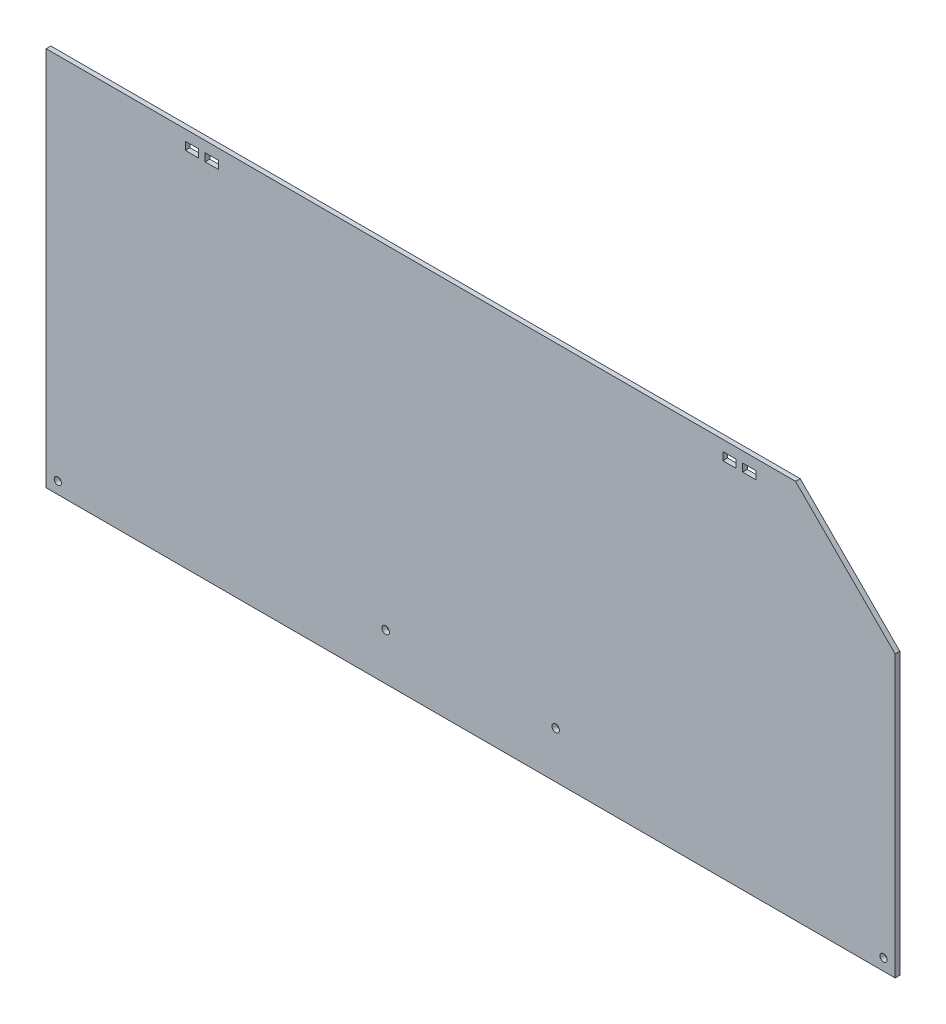
from build123d import *

# Parameters (mm, degrees)
EXTRUDE_1_DEPTH     = 4
SKETCH_2_W          = 11.5
SKETCH_2_H          = 6.8
CUT_EXTRUDE_1_DEPTH = 747.201380326
SKETCH_3_R          = 3.25
CUT_EXTRUDE_2_DEPTH = 747.201380326
SKETCH_4_R          = 3.1
CUT_EXTRUDE_3_DEPTH = 747.201380326


with BuildPart() as part:
    # Эскиз1 → Бобышка-Вытянуть1 (new body)
    with BuildSketch(Plane.XY):
        Polygon((-669.5, 2.95), (-26.041378029, 2.95), (59.5, 88.491378029), (59.5, 329.5), (-669.5, 329.5), align=None)
    extrude(amount=EXTRUDE_1_DEPTH)

    # Эскиз2 → Вырез-Вытянуть1 (cut, through all)
    with BuildSketch(Plane(origin=(0, 0, 0), x_dir=(-1, 0, 0), z_dir=(0, 0, -1))):
        with Locations((65.75, 15.42)):
            Rectangle(SKETCH_2_W, SKETCH_2_H)
        with Locations((82.75, 15.42)):
            Rectangle(SKETCH_2_W, SKETCH_2_H)
        with Locations((527.25, 15.42)):
            Rectangle(SKETCH_2_W, SKETCH_2_H)
        with Locations((544.25, 15.42)):
            Rectangle(SKETCH_2_W, SKETCH_2_H)
    extrude(amount=-CUT_EXTRUDE_1_DEPTH, mode=Mode.SUBTRACT)

    # Эскиз3 → Вырез-Вытянуть2 (cut, through all)
    with BuildSketch(Plane(origin=(0, 0, 0), x_dir=(-1, 0, 0), z_dir=(0, 0, -1))):
        with Locations((232, 289.5)):
            Circle(SKETCH_3_R)
        with Locations((378, 289.5)):
            Circle(SKETCH_3_R)
    extrude(amount=-CUT_EXTRUDE_2_DEPTH, mode=Mode.SUBTRACT)

    # Эскиз4 → Вырез-Вытянуть3 (cut, through all)
    with BuildSketch(Plane(origin=(0, 0, 0), x_dir=(-1, 0, 0), z_dir=(0, 0, -1))):
        with Locations((-49.5, 319.5)):
            Circle(SKETCH_4_R)
        with Locations((659.5, 319.5)):
            Circle(SKETCH_4_R)
    extrude(amount=-CUT_EXTRUDE_3_DEPTH, mode=Mode.SUBTRACT)


with BuildPart() as body_2:
    # Зеркальное отражение1: mirrored copy
    add(part.part.mirror(Plane.ZX))


solid = body_2.part
